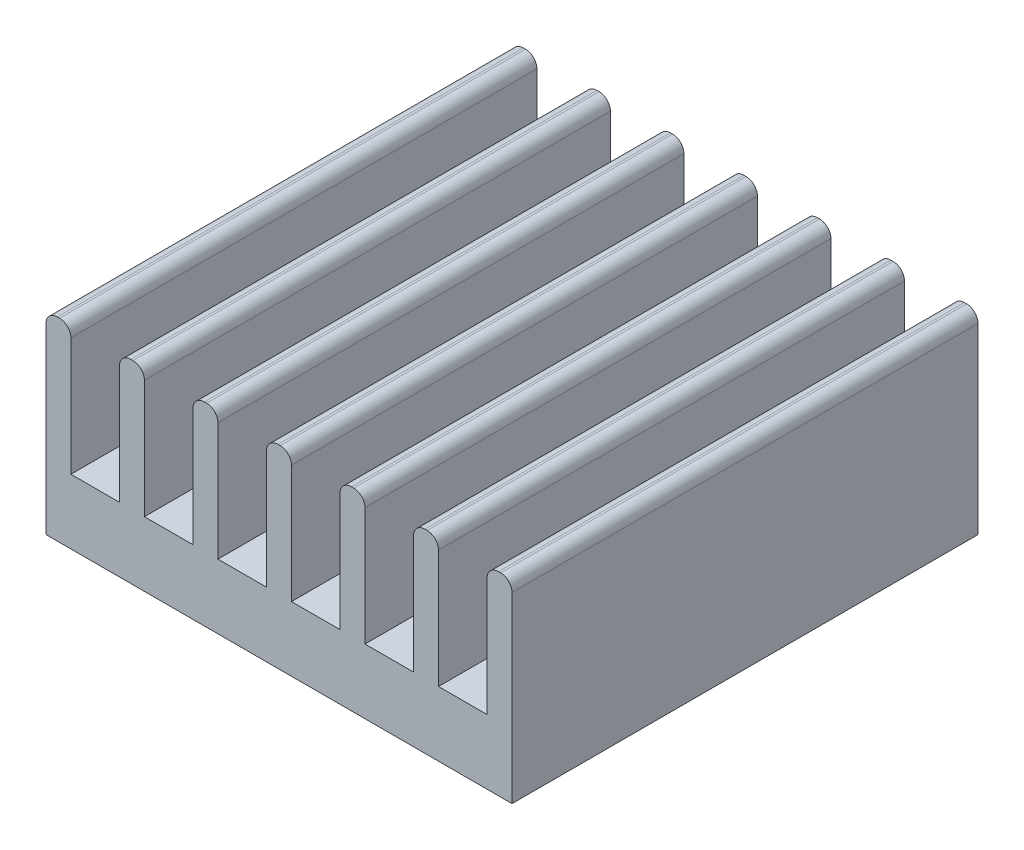
from build123d import *

# Parameters (mm, degrees)
SKETCH1_W           = 14.4
SKETCH1_H           = 14.4
BOSS_EXTRUDE1_DEPTH = 2
SKETCH2_W           = 0.77
SKETCH2_H           = 4
BOSS_EXTRUDE2_DEPTH = 14.4
FILLET1_R           = 0.35


with BuildPart() as part:
    # Sketch1 → Boss-Extrude1 (new body)
    with BuildSketch(Plane(origin=(0, 0, 0), x_dir=(1, 0, 0), z_dir=(0, 1, 0))):
        with Locations((7.2, 7.2)):
            Rectangle(SKETCH1_W, SKETCH1_H)
    extrude(amount=-BOSS_EXTRUDE1_DEPTH)

    # Sketch2 → Boss-Extrude2 (add)
    with BuildSketch(Plane.XY):
        with Locations((2.656666667, 2)):
            Rectangle(SKETCH2_W, SKETCH2_H)
        with Locations((0.385, 2)):
            Rectangle(SKETCH2_W, SKETCH2_H)
        with Locations((4.928333333, 2)):
            Rectangle(SKETCH2_W, SKETCH2_H)
        with Locations((7.2, 2)):
            Rectangle(SKETCH2_W, SKETCH2_H)
        with Locations((9.471666667, 2)):
            Rectangle(SKETCH2_W, SKETCH2_H)
        with Locations((11.743333333, 2)):
            Rectangle(SKETCH2_W, SKETCH2_H)
        with Locations((14.015, 2)):
            Rectangle(SKETCH2_W, SKETCH2_H)
    extrude(amount=-BOSS_EXTRUDE2_DEPTH)

    # Fillet1
    fillet1_edges = [part.edges().sort_by_distance(p)[0] for p in [
        (0.77, 4, -7.2),
        (0, 4, -7.2),
        (3.041666667, 4, -7.2),
        (2.271666667, 4, -7.2),
        (5.313333333, 4, -7.2),
        (4.543333333, 4, -7.2),
        (7.585, 4, -7.2),
        (6.815, 4, -7.2),
        (9.856666667, 4, -7.2),
        (9.086666667, 4, -7.2),
        (12.128333333, 4, -7.2),
        (11.358333333, 4, -7.2),
        (14.4, 4, -7.2),
        (13.63, 4, -7.2),
    ]]
    fillet(fillet1_edges, radius=FILLET1_R)


solid = part.part
